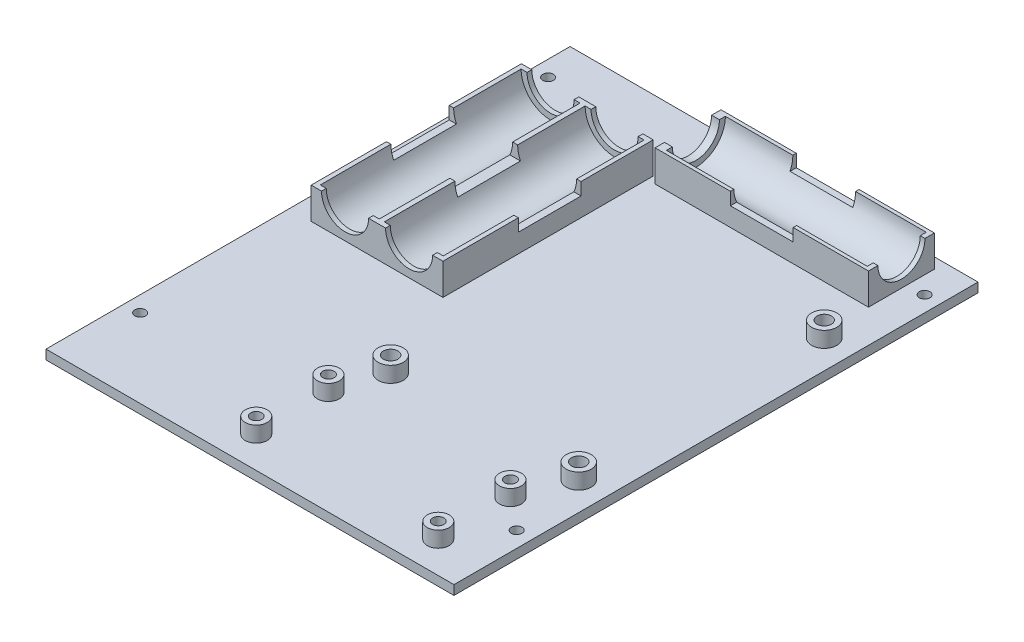
from build123d import *

# Parameters (mm, degrees)
ESQUISSE1_W              = 130
ESQUISSE1_H              = 167
BOSS_EXTRU_1_DEPTH       = 3
ESQUISSE6_R              = 3.5
ESQUISSE6_R_2            = 4
BOSS_EXTRU_3_DEPTH       = 5
ESQUISSE11_W             = 67
ESQUISSE11_H             = 10
BOSS_EXTRU_6_DEPTH       = 49
ENL_V_MAT_EXTRU_3_REACH  = 113.374
ESQUISSE12_R             = 7.5
ESQUISSE12_W             = 7
ESQUISSE12_H             = 10
ESQUISSE13_R             = 9.4
ENL_V_MAT_EXTRU_4_DEPTH  = 65.5
BOSS_EXTRU_7_DEPTH       = 1.5
ESQUISSE15_W             = 20
ESQUISSE15_H             = 4
ENL_V_MAT_EXTRU_5_DEPTH  = 43.7
ESQUISSE16_W             = 21
ESQUISSE16_H             = 10
BOSS_EXTRU_8_DEPTH       = 78.5
ESQUISSE17_W             = 10.5
ESQUISSE17_H             = 10
ESQUISSE17_W_2           = 20
ESQUISSE17_H_2           = 4
ENL_V_MAT_EXTRU_6_DEPTH  = 24.2
ENL_V_MAT_EXTRU_7_REACH  = 148.361
ESQUISSE18_R             = 7.5
ESQUISSE19_R             = 9.4
ENL_V_MAT_EXTRU_8_DEPTH  = 65.5
BOSS_EXTRU_9_DEPTH       = 1.5
ESQUISSE21_R             = 2.3
ESQUISSE21_R_2           = 1.8
ENL_V_MAT_EXTRU_9_DEPTH  = 6.1
ESQUISSE22_R             = 1.7
ENL_V_MAT_EXTRU_10_DEPTH = 107.288522428


with BuildPart() as part:
    # Esquisse1 → Boss.-Extru.1 (new body)
    with BuildSketch(Plane(origin=(0, 0, 0), x_dir=(1, 0, 0), z_dir=(0, 1, 0))):
        Rectangle(ESQUISSE1_W, ESQUISSE1_H)
    extrude(amount=BOSS_EXTRU_1_DEPTH)

    # Esquisse6 → Boss.-Extru.3 (add)
    with BuildSketch(Plane(origin=(0, 3, 0), x_dir=(1, 0, 0), z_dir=(0, 1, 0))):
        with Locations(Location((-8, -73.5, 0), (0, 0, 90))):
            Circle(ESQUISSE6_R)
        with Locations(Location((-8, -50.5, 0), (0, 0, 90))):
            Circle(ESQUISSE6_R)
        with Locations(Location((50, -50.5, 0), (0, 0, 90))):
            Circle(ESQUISSE6_R)
        with Locations(Location((50, -73.5, 0), (0, 0, 90))):
            Circle(ESQUISSE6_R)
        with Locations(Location((56, 43.5, 0), (0, 0, 90))):
            Circle(ESQUISSE6_R_2)
        with Locations(Location((56, -34.732, 0), (0, 0, 90))):
            Circle(ESQUISSE6_R_2)
        with Locations(Location((-3.436, -35.232, 0), (0, 0, 90))):
            Circle(ESQUISSE6_R_2)
    extrude(amount=BOSS_EXTRU_3_DEPTH)

    # Esquisse11 → Boss.-Extru.6 (add)
    with BuildSketch(Plane.ZY.offset(65)):
        with Locations((-27.5, 8)):
            Rectangle(ESQUISSE11_W, ESQUISSE11_H)
    extrude(amount=-BOSS_EXTRU_6_DEPTH)

    # Esquisse12 → Enlèv. mat.-Extru.3 (cut, up to next)
    with BuildSketch(Plane.XY.offset(6), mode=Mode.PRIVATE) as enl_v_mat_extru_3_sk1:
        with Locations((-47.2, 13)):
            Circle(ESQUISSE12_R)
    enl_v_mat_extru_3_tool1 = extrude(enl_v_mat_extru_3_sk1.sketch, amount=-ENL_V_MAT_EXTRU_3_REACH, mode=Mode.PRIVATE) & part.part
    # Esquisse12 → Enlèv. mat.-Extru.3 (cut, up to next)
    with BuildSketch(Plane.XY.offset(6), mode=Mode.PRIVATE) as enl_v_mat_extru_3_sk2:
        with Locations((-26.8, 13)):
            Circle(ESQUISSE12_R)
    enl_v_mat_extru_3_tool2 = extrude(enl_v_mat_extru_3_sk2.sketch, amount=-ENL_V_MAT_EXTRU_3_REACH, mode=Mode.PRIVATE) & part.part
    # Esquisse12 → Enlèv. mat.-Extru.3 (cut, up to next)
    with BuildSketch(Plane.XY.offset(6), mode=Mode.PRIVATE) as enl_v_mat_extru_3_sk3:
        with Locations((-61.5, 8)):
            Rectangle(ESQUISSE12_W, ESQUISSE12_H)
    enl_v_mat_extru_3_tool3 = extrude(enl_v_mat_extru_3_sk3.sketch, amount=-ENL_V_MAT_EXTRU_3_REACH, mode=Mode.PRIVATE) & part.part
    add(enl_v_mat_extru_3_tool1.solids().sort_by_distance((-47.2, 13, 6))[0], mode=Mode.SUBTRACT)
    add(enl_v_mat_extru_3_tool2.solids().sort_by_distance((-26.8, 13, 6))[0], mode=Mode.SUBTRACT)
    add(enl_v_mat_extru_3_tool3.solids().sort_by_distance((-61.5, 8, 6))[0], mode=Mode.SUBTRACT)

    # Esquisse13 → Enlèv. mat.-Extru.4 (cut)
    with BuildSketch(Plane.XY.offset(6)):
        with Locations((-47.2, 13)):
            Circle(ESQUISSE13_R)
        with Locations((-26.8, 13)):
            Circle(ESQUISSE13_R)
    extrude(amount=-ENL_V_MAT_EXTRU_4_DEPTH, mode=Mode.SUBTRACT)

    # Esquisse14 → Boss.-Extru.7 (add)
    with BuildSketch(Plane.XY.offset(6)):
        with BuildLine():
            Line((-58, 13), (-54.7, 13))
            ThreePointArc((-54.7, 13), (-47.2, 5.5), (-39.7, 13))
            Line((-39.7, 13), (-34.3, 13))
            ThreePointArc((-34.3, 13), (-26.8, 5.5), (-19.3, 13))
            Line((-19.3, 13), (-16, 13))
            Line((-16, 13), (-16, 3))
            Line((-16, 3), (-58, 3))
            Line((-58, 3), (-58, 13))
        make_face()
    extrude(amount=-BOSS_EXTRU_7_DEPTH)

    # Esquisse15 → Enlèv. mat.-Extru.5 (cut)
    with BuildSketch(Plane.ZY.offset(58)):
        with Locations((-28, 11)):
            Rectangle(ESQUISSE15_W, ESQUISSE15_H)
    extrude(amount=-ENL_V_MAT_EXTRU_5_DEPTH, mode=Mode.SUBTRACT)

    # Esquisse16 → Boss.-Extru.8 (add)
    with BuildSketch(Plane(origin=(65, 0, 0), x_dir=(0, 0, -1), z_dir=(1, 0, 0))):
        with Locations((69.6, 8)):
            Rectangle(ESQUISSE16_W, ESQUISSE16_H)
    extrude(amount=-BOSS_EXTRU_8_DEPTH)

    # Esquisse17 → Enlèv. mat.-Extru.6 (cut)
    with BuildSketch(Plane(origin=(0, 0, -80.1), x_dir=(-1, 0, 0), z_dir=(0, 0, -1))):
        with Locations((-59.75, 8)):
            Rectangle(ESQUISSE17_W, ESQUISSE17_H)
        with Locations((-20.5, 11)):
            Rectangle(ESQUISSE17_W_2, ESQUISSE17_H_2)
    extrude(amount=-ENL_V_MAT_EXTRU_6_DEPTH, mode=Mode.SUBTRACT)

    # Esquisse18 → Enlèv. mat.-Extru.7 (cut, up to next)
    with BuildSketch(Plane(origin=(54.5, 0, 0), x_dir=(0, 0, -1), z_dir=(1, 0, 0)), mode=Mode.PRIVATE) as enl_v_mat_extru_7_sk1:
        with Locations((69.6, 13)):
            Circle(ESQUISSE18_R)
    enl_v_mat_extru_7_tool1 = extrude(enl_v_mat_extru_7_sk1.sketch, amount=-ENL_V_MAT_EXTRU_7_REACH, mode=Mode.PRIVATE) & part.part
    add(enl_v_mat_extru_7_tool1.solids().sort_by_distance((54.5, 13, -69.6))[0], mode=Mode.SUBTRACT)

    # Esquisse19 → Enlèv. mat.-Extru.8 (cut)
    with BuildSketch(Plane(origin=(54.5, 0, 0), x_dir=(0, 0, -1), z_dir=(1, 0, 0))):
        with Locations((69.6, 13)):
            Circle(ESQUISSE19_R)
    extrude(amount=-ENL_V_MAT_EXTRU_8_DEPTH, mode=Mode.SUBTRACT)

    # Esquisse20 → Boss.-Extru.9 (add)
    with BuildSketch(Plane(origin=(54.5, 0, 0), x_dir=(0, 0, -1), z_dir=(1, 0, 0))):
        with BuildLine():
            Line((59.1, 13), (62.1, 13))
            ThreePointArc((62.1, 13), (69.6, 5.5), (77.1, 13))
            Line((77.1, 13), (80.1, 13))
            Line((80.1, 13), (80.1, 3))
            Line((80.1, 3), (59.1, 3))
            Line((59.1, 3), (59.1, 13))
        make_face()
    extrude(amount=-BOSS_EXTRU_9_DEPTH)

    # Esquisse21 → Enlèv. mat.-Extru.9 (cut)
    with BuildSketch(Plane(origin=(0, 8, 0), x_dir=(1, 0, 0), z_dir=(0, 1, 0))):
        with Locations(Location((56, 43.5, 0), (0, 0, 270))):
            Circle(ESQUISSE21_R)
        with Locations(Location((56, -34.732, 0), (0, 0, 270))):
            Circle(ESQUISSE21_R)
        with Locations(Location((-3.436, -35.232, 0), (0, 0, 270))):
            Circle(ESQUISSE21_R)
        with Locations(Location((50, -50.5, 0), (0, 0, 270))):
            Circle(ESQUISSE21_R_2)
        with Locations(Location((50, -73.5, 0), (0, 0, 270))):
            Circle(ESQUISSE21_R_2)
        with Locations(Location((-8, -50.5, 0), (0, 0, 270))):
            Circle(ESQUISSE21_R_2)
        with Locations(Location((-8, -73.5, 0), (0, 0, 270))):
            Circle(ESQUISSE21_R_2)
    extrude(amount=-ENL_V_MAT_EXTRU_9_DEPTH, mode=Mode.SUBTRACT)

    # Esquisse22 → Enlèv. mat.-Extru.10 (cut, through all)
    with BuildSketch(Plane(origin=(0, 3, 0), x_dir=(1, 0, 0), z_dir=(0, 1, 0))):
        with Locations(Location((-60, 71.5, 0), (0, 0, 270))):
            Circle(ESQUISSE22_R)
        with Locations(Location((60, 71.5, 0), (0, 0, 270))):
            Circle(ESQUISSE22_R)
        with Locations(Location((60, -58.5, 0), (0, 0, 270))):
            Circle(ESQUISSE22_R)
        with Locations(Location((-60, -58.5, 0), (0, 0, 270))):
            Circle(ESQUISSE22_R)
    extrude(amount=-ENL_V_MAT_EXTRU_10_DEPTH, mode=Mode.SUBTRACT)


solid = part.part
